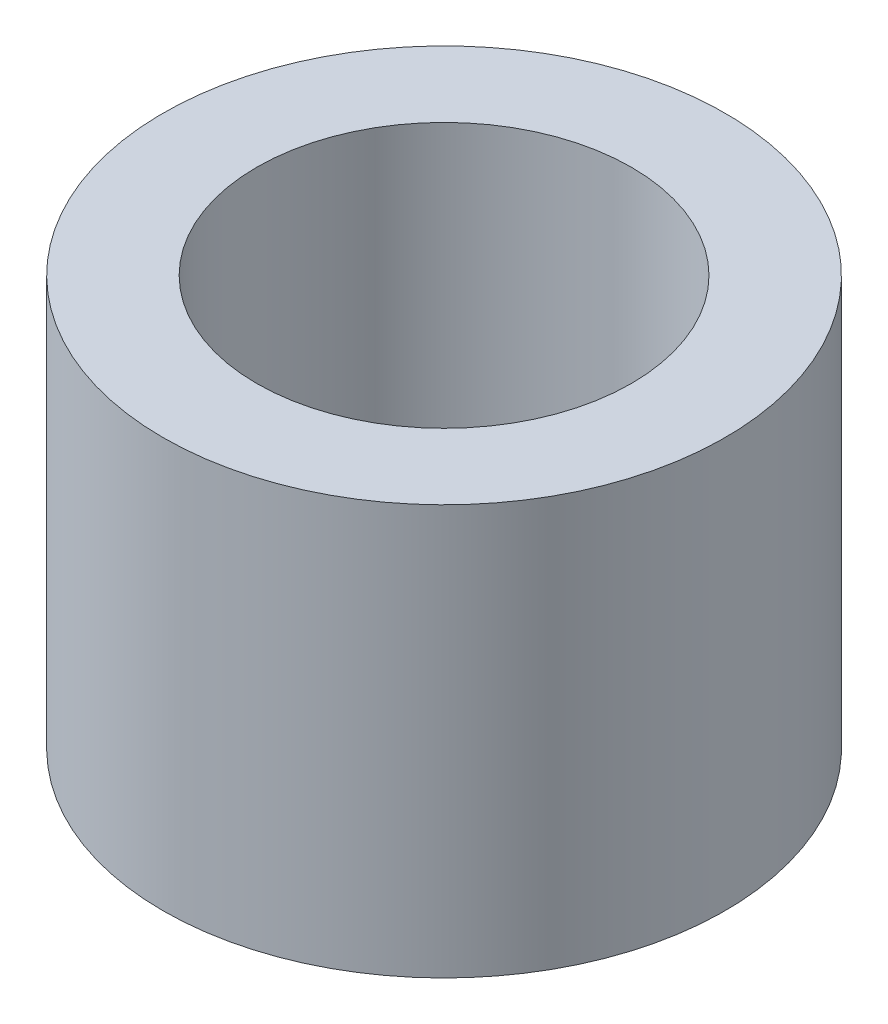
from build123d import *

# Parameters (mm, degrees)
SKETCH1_R           = 2.4
SKETCH1_R_2         = 1.6
BOSS_EXTRUDE1_DEPTH = 3.5


with BuildPart() as part:
    # Sketch1 → Boss-Extrude1 (new body)
    with BuildSketch(Plane(origin=(0, 0, 0), x_dir=(1, 0, 0), z_dir=(0, 1, 0))):
        with Locations(Location((0, 0, 0), (0, 0, 270))):
            Circle(SKETCH1_R)
        with Locations(Location((0, 0, 0), (0, 0, 270))):
            Circle(SKETCH1_R_2, mode=Mode.SUBTRACT)
    extrude(amount=BOSS_EXTRUDE1_DEPTH)


solid = part.part
